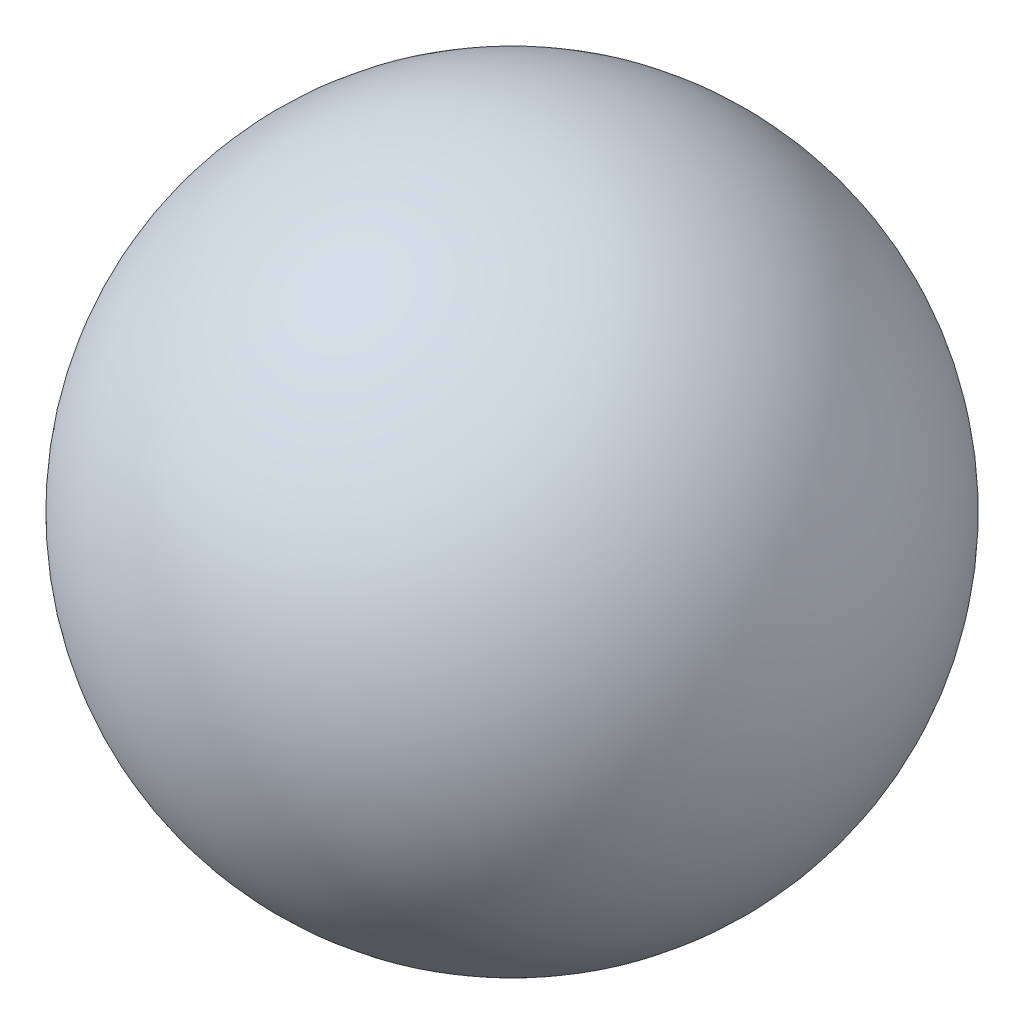
from build123d import *


with BuildPart() as part:
    # Sketch1 → Revolve1 (revolve)
    with BuildSketch(Plane.XY):
        with BuildLine():
            Line((0, 16.9), (0, -16.9))
            ThreePointArc((0, -16.9), (16.9, 0), (0, 16.9))
        make_face()
    revolve(axis=Axis((0, 16.9, 0), (0, -1, 0)))


solid = part.part
